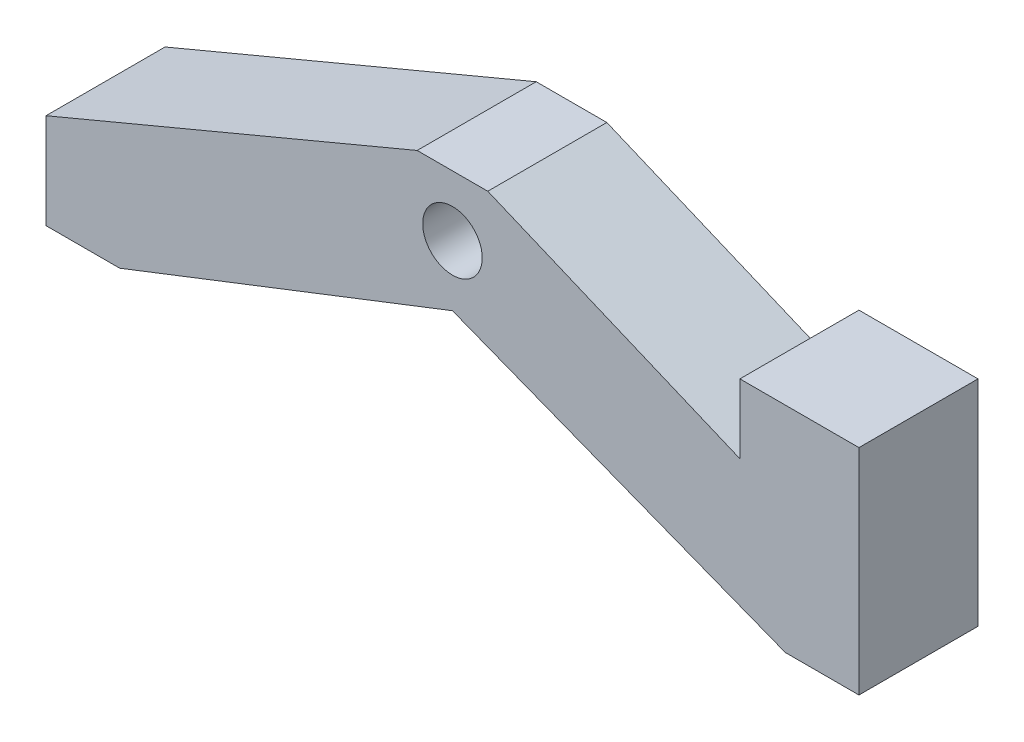
from build123d import *

# Parameters (mm, degrees)
SKETCH1_R           = 2.5
BOSS_EXTRUDE1_DEPTH = 5
BOSS_EXTRUDE2_DEPTH = 10


with BuildPart() as part:
    # Sketch1 → Boss-Extrude1 (new, symmetric)
    with BuildSketch(Plane.XY):
        Polygon((0, 0), (27.955990735, -10.884051729), (34.143878012, -10.884051729), (34.143878012, -2.884051729), (2.966226636, 10.176810065), (-2.966226636, 10.176810065), (-34.143878012, -2.884051729), (-34.143878012, -10.884051729), (-27.955990735, -10.884051729), align=None)
        with Locations((0, 5.088405032)):
            Circle(SKETCH1_R, mode=Mode.SUBTRACT)
    extrude(amount=BOSS_EXTRUDE1_DEPTH, both=True)

    # Sketch3 → Boss-Extrude2 (add)
    with BuildSketch(Plane.XY.offset(5)):
        Polygon((34.143878012, -2.884051729), (24.143878012, 1.305122637), (24.143878012, 7.115948271), (34.143878012, 7.115948271), align=None)
    extrude(amount=-BOSS_EXTRUDE2_DEPTH)


solid = part.part
